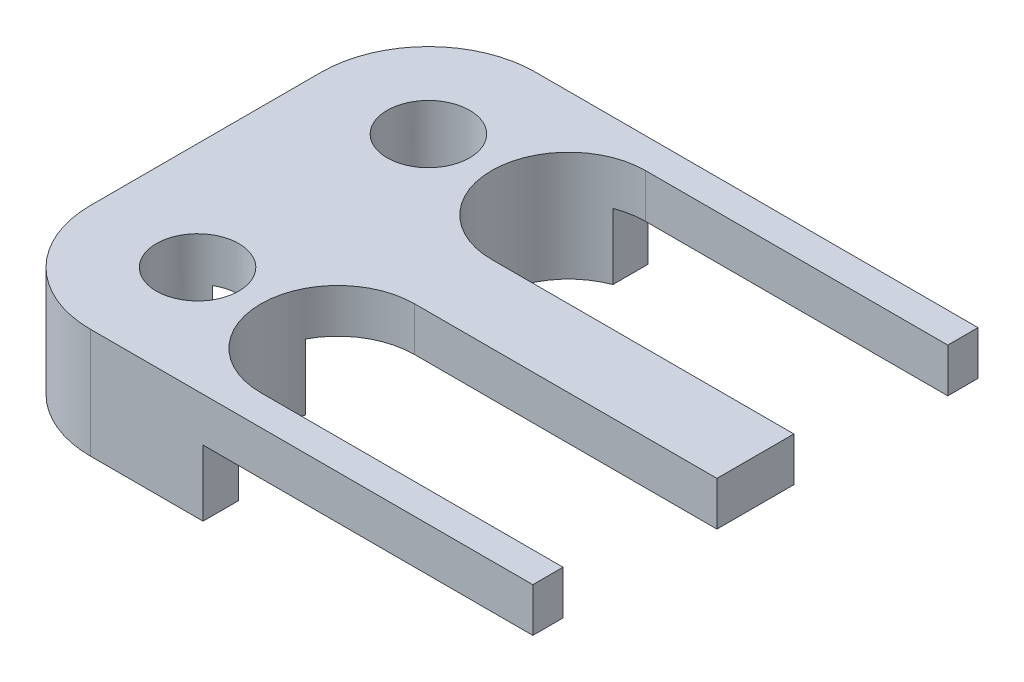
from build123d import *

# Parameters (mm, degrees)
CROQUIS1_R              = 3.75
SALIENTE_EXTRUIR1_DEPTH = 10
CROQUIS2_W              = 40.5
CROQUIS2_H              = 4
SALIENTE_EXTRUIR2_DEPTH = 30
CROQUIS3_W              = 14.5
CROQUIS3_H              = 6
CORTAR_EXTRUIR1_DEPTH   = 38.550798926
CORTAR_EXTRUIR2_DEPTH   = 47.15327724


with BuildPart() as part:
    # Croquis1 → Saliente-Extruir1 (new body)
    with BuildSketch(Plane(origin=(0, 0, 0), x_dir=(1, 0, 0), z_dir=(0, 1, 0))):
        with BuildLine():
            Line((-9.75, -10.5), (-9.75, 10.5))
            ThreePointArc((-9.75, 10.5), (-6.894291117, 17.394291117), (0, 20.25))
            Line((0, 20.25), (10.25, 20.25))
            Line((10.25, 20.25), (10.25, -20.25))
            Line((10.25, -20.25), (0, -20.25))
            ThreePointArc((0, -20.25), (-6.894291117, -17.394291117), (-9.75, -10.5))
        make_face()
        with Locations(Location((0, 10.5, 0), (0, 0, 270))):
            Circle(CROQUIS1_R, mode=Mode.SUBTRACT)
        with Locations(Location((0, -10.5, 0), (0, 0, 270))):
            Circle(CROQUIS1_R, mode=Mode.SUBTRACT)
    extrude(amount=SALIENTE_EXTRUIR1_DEPTH)

    # Croquis2 → Saliente-Extruir2 (add)
    with BuildSketch(Plane(origin=(10.25, 0, 0), x_dir=(0, 0, -1), z_dir=(1, 0, 0))):
        with Locations((0, 8)):
            Rectangle(CROQUIS2_W, CROQUIS2_H)
    extrude(amount=SALIENTE_EXTRUIR2_DEPTH)

    # Croquis3 → Cortar-Extruir1 (cut, through all)
    with BuildSketch(Plane(origin=(10.25, 0, 0), x_dir=(0, 0, -1), z_dir=(1, 0, 0))):
        with Locations((0, 3)):
            Rectangle(CROQUIS3_W, CROQUIS3_H)
    extrude(amount=-CORTAR_EXTRUIR1_DEPTH, mode=Mode.SUBTRACT)

    # Croquis5 → Cortar-Extruir2 (cut, through all)
    with BuildSketch(Plane(origin=(0, 10, 0), x_dir=(1, 0, 0), z_dir=(0, 1, 0))):
        with BuildLine():
            Line((12.75, -3.5), (40.25, -3.5))
            ThreePointArc((40.25, -3.5), (47.25, -10.5), (40.25, -17.5))
            Line((40.25, -17.5), (12.75, -17.5))
            ThreePointArc((12.75, -17.5), (5.75, -10.5), (12.75, -3.5))
        make_face()
        with BuildLine():
            Line((12.75, 3.5), (40.25, 3.5))
            ThreePointArc((40.25, 3.5), (47.25, 10.5), (40.25, 17.5))
            Line((40.25, 17.5), (12.75, 17.5))
            ThreePointArc((12.75, 17.5), (5.75, 10.5), (12.75, 3.5))
        make_face()
    extrude(amount=-CORTAR_EXTRUIR2_DEPTH, mode=Mode.SUBTRACT)


solid = part.part
